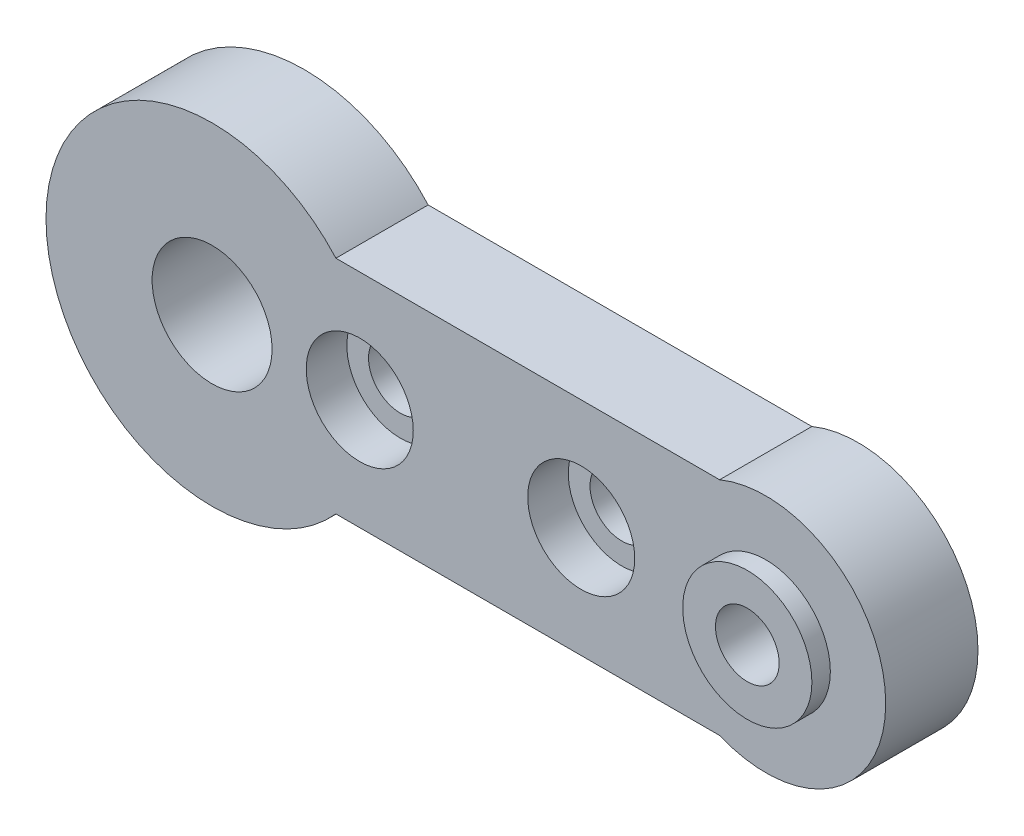
from build123d import *

# Parameters (mm, degrees)
BOSS_EXTRUDE1_START     = -9
SKETCH1_W               = 30
SKETCH1_H               = 12
BOSS_EXTRUDE1_DEPTH     = 5
BOSS_EXTRUDE2_START     = -9
SKETCH2_R               = 9
BOSS_EXTRUDE2_DEPTH     = 5
BOSS_EXTRUDE3_START     = -9
SKETCH3_R               = 6.5
BOSS_EXTRUDE3_DEPTH     = 5
CUT_EXTRUDE1_DEPTH      = 39.655530005
CUT_EXTRUDE1_DEPTH_BACK = 39.655530005
SKETCH4_R               = 3.25
CUT_EXTRUDE2_DEPTH      = 39.655530005
CUT_EXTRUDE2_DEPTH_BACK = 39.655530005
SKETCH5_R               = 1.725
CUT_EXTRUDE3_START      = -6.2
SKETCH6_R               = 2.9
CUT_EXTRUDE3_DEPTH      = 2.2
CUT_EXTRUDE4_START      = -6.2
SKETCH7_R               = 2.9
CUT_EXTRUDE4_DEPTH      = 2.2
CUT_EXTRUDE5_START      = -9
SKETCH8_R               = 2.9
CUT_EXTRUDE5_DEPTH      = 2.2
BOSS_EXTRUDE4_START     = -4
SKETCH9_R               = 3.5
BOSS_EXTRUDE4_DEPTH     = 1
CUT_EXTRUDE6_DEPTH      = 39.655530005
CUT_EXTRUDE6_DEPTH_BACK = 39.655530005
SKETCH10_R              = 1.725


with BuildPart() as part:
    # Sketch1 → Boss-Extrude1 (new body)
    with BuildSketch(Plane.XY.offset(BOSS_EXTRUDE1_START)):
        with Locations((15, 0)):
            Rectangle(SKETCH1_W, SKETCH1_H)
    extrude(amount=BOSS_EXTRUDE1_DEPTH)

    # Sketch2 → Boss-Extrude2 (add)
    with BuildSketch(Plane.XY.offset(BOSS_EXTRUDE2_START)):
        Circle(SKETCH2_R)
    extrude(amount=BOSS_EXTRUDE2_DEPTH)

    # Sketch3 → Boss-Extrude3 (add)
    with BuildSketch(Plane.XY.offset(BOSS_EXTRUDE3_START)):
        with Locations((30, 0)):
            Circle(SKETCH3_R)
    extrude(amount=BOSS_EXTRUDE3_DEPTH)

    # Sketch4 → Cut-Extrude1 (cut, two sides: drawn at the far end of the back side and taken through both)
    with BuildSketch(Plane.XY.offset(-CUT_EXTRUDE1_DEPTH_BACK)):
        Circle(SKETCH4_R)
    extrude(amount=CUT_EXTRUDE1_DEPTH + CUT_EXTRUDE1_DEPTH_BACK, mode=Mode.SUBTRACT)

    # Sketch5 → Cut-Extrude2 (cut, two sides: drawn at the far end of the back side and taken through both)
    with BuildSketch(Plane.XY.offset(-CUT_EXTRUDE2_DEPTH_BACK)):
        with Locations((8, 0)):
            Circle(SKETCH5_R)
        with Locations((20, 0)):
            Circle(SKETCH5_R)
        with Locations((30, 0)):
            Circle(SKETCH5_R)
    extrude(amount=CUT_EXTRUDE2_DEPTH + CUT_EXTRUDE2_DEPTH_BACK, mode=Mode.SUBTRACT)

    # Sketch6 → Cut-Extrude3 (cut)
    with BuildSketch(Plane.XY.offset(CUT_EXTRUDE3_START)):
        with Locations((8, 0)):
            Circle(SKETCH6_R)
    extrude(amount=CUT_EXTRUDE3_DEPTH, mode=Mode.SUBTRACT)

    # Sketch7 → Cut-Extrude4 (cut)
    with BuildSketch(Plane.XY.offset(CUT_EXTRUDE4_START)):
        with Locations((20, 0)):
            Circle(SKETCH7_R)
    extrude(amount=CUT_EXTRUDE4_DEPTH, mode=Mode.SUBTRACT)

    # Sketch8 → Cut-Extrude5 (cut)
    with BuildSketch(Plane.XY.offset(CUT_EXTRUDE5_START)):
        with Locations((30, 0)):
            Circle(SKETCH8_R)
    extrude(amount=CUT_EXTRUDE5_DEPTH, mode=Mode.SUBTRACT)

    # Sketch9 → Boss-Extrude4 (add)
    with BuildSketch(Plane.XY.offset(BOSS_EXTRUDE4_START)):
        with Locations((30, 0)):
            Circle(SKETCH9_R)
    extrude(amount=BOSS_EXTRUDE4_DEPTH)

    # Sketch10 → Cut-Extrude6 (cut, two sides: drawn at the far end of the back side and taken through both)
    with BuildSketch(Plane.XY.offset(-CUT_EXTRUDE6_DEPTH_BACK)):
        with Locations((30, 0)):
            Circle(SKETCH10_R)
    extrude(amount=CUT_EXTRUDE6_DEPTH + CUT_EXTRUDE6_DEPTH_BACK, mode=Mode.SUBTRACT)


solid = part.part
